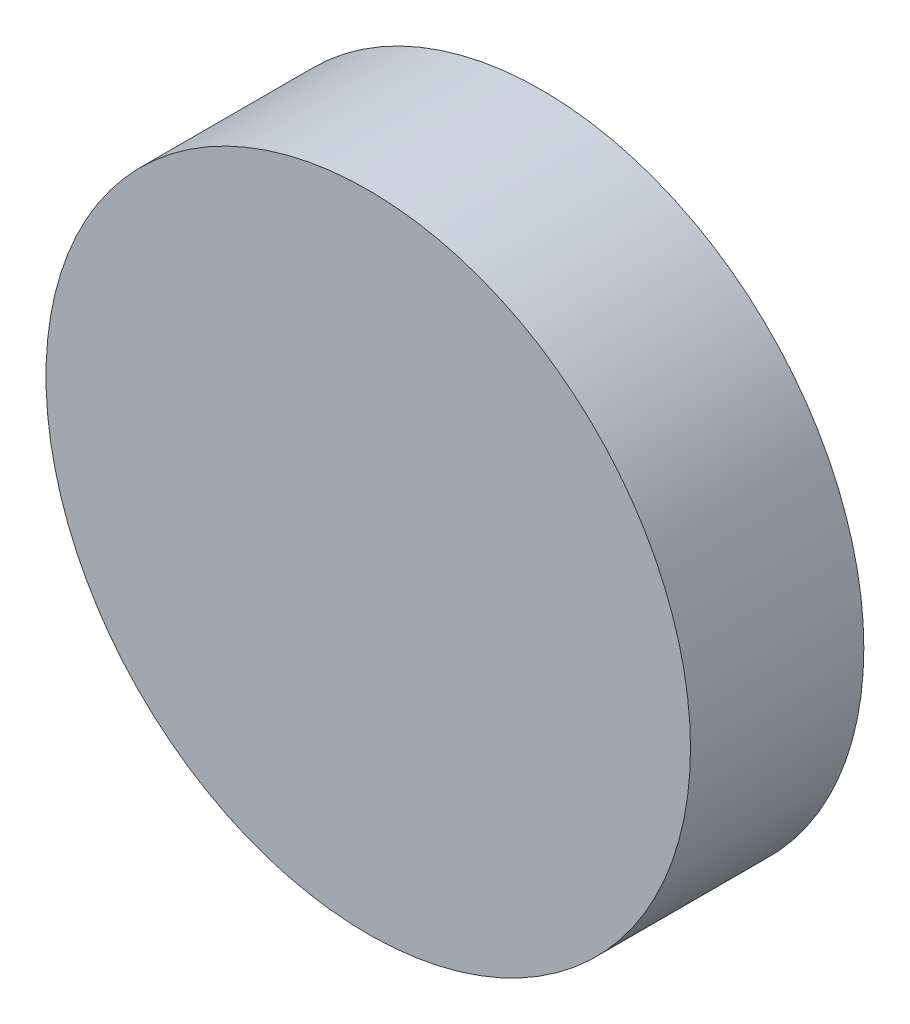
from build123d import *

# Parameters (mm, degrees)
IZIM2_R                     = 18.591593623
Y_KSEKLIK_EKSTR_ZYON1_DEPTH = 10


with BuildPart() as part:
    # Çizim2 → Yükseklik-Ekstrüzyon1 (new body)
    with BuildSketch(Plane.XY):
        with Locations((-2.805971375, 0)):
            Circle(IZIM2_R)
    extrude(amount=Y_KSEKLIK_EKSTR_ZYON1_DEPTH)


solid = part.part
